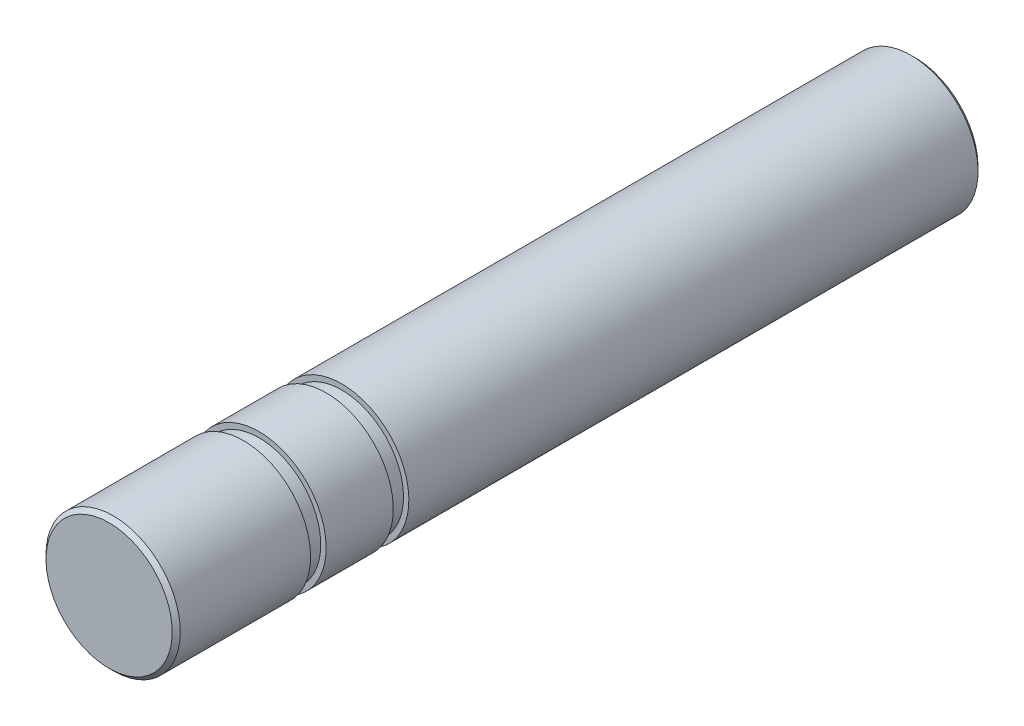
from build123d import *

# Parameters (mm, degrees)
CHAMFER1_SIZE = 0.1905


with BuildPart() as part:
    # Sketch3 → Revolve1 (revolve)
    with BuildSketch(Plane(origin=(0, 0, 0), x_dir=(0, 0, -1), z_dir=(1, 0, 0)), mode=Mode.PRIVATE) as revolve1_sk:
        Polygon((-19.05, 3.175), (-19.05, 0), (19.05, 0), (19.05, 3.175), (-8.0518, 3.175), (-8.0518, 2.921), (-8.7884, 2.921), (-8.7884, 3.175), (-11.9634, 3.175), (-11.9634, 2.921), (-12.7, 2.921), (-12.7, 3.175), align=None)
    revolve(revolve1_sk.sketch.rotate(Axis((0, 0, 19.05), (0, 0, -1)), 180), axis=Axis((0, 0, 19.05), (0, 0, -1)))

    # Chamfer1
    chamfer1_edges = [part.edges().sort_by_distance(p)[0] for p in [
        (0, 3.175, 19.05),
        (0, 3.175, -19.05),
    ]]
    chamfer(chamfer1_edges, length=CHAMFER1_SIZE)


solid = part.part
